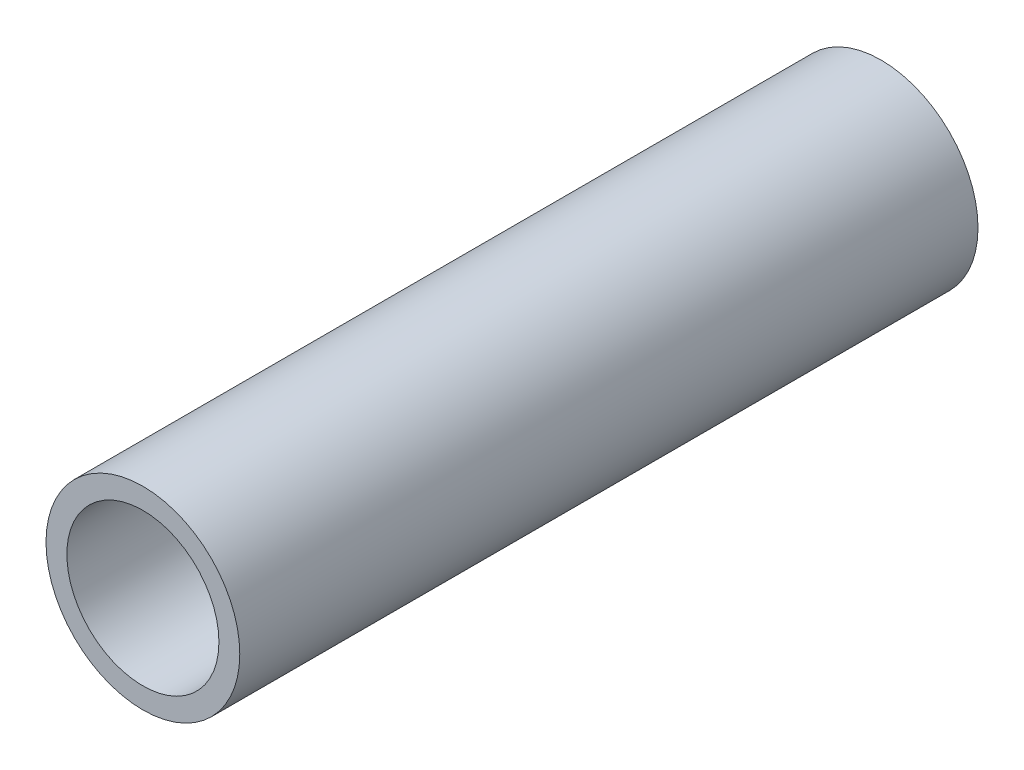
from build123d import *

# Parameters (mm, degrees)
SKETCH1_R           = 13.335
SKETCH1_R_2         = 10.4648
BOSS_EXTRUDE1_DEPTH = 50.8


with BuildPart() as part:
    # Sketch1 → Boss-Extrude1 (new, symmetric)
    with BuildSketch(Plane.XY):
        Circle(SKETCH1_R)
        Circle(SKETCH1_R_2, mode=Mode.SUBTRACT)
    extrude(amount=BOSS_EXTRUDE1_DEPTH, both=True)


solid = part.part
